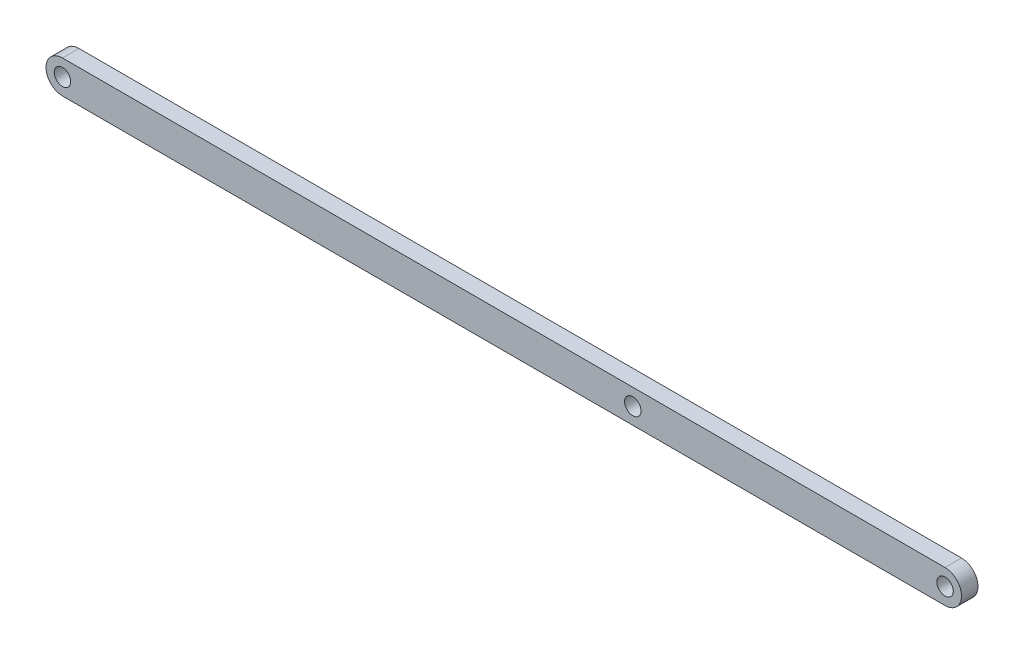
from build123d import *

# Parameters (mm, degrees)
ESBO_O1_R                = 2.5
RESSALTO_EXTRUS_O1_DEPTH = 5


with BuildPart() as part:
    # Esboço1 → Ressalto-extrusão1 (new body)
    with BuildSketch(Plane.XY):
        with BuildLine():
            Line((-227.28, 5), (40.72, 5))
            ThreePointArc((40.72, 5), (45.72, 0), (40.72, -5))
            Line((40.72, -5), (-227.28, -5))
            ThreePointArc((-227.28, -5), (-232.28, 0), (-227.28, 5))
        make_face()
        with Locations((-227.28, 0)):
            Circle(ESBO_O1_R, mode=Mode.SUBTRACT)
        with Locations((40.72, 0)):
            Circle(ESBO_O1_R, mode=Mode.SUBTRACT)
        with Locations((-54.1, 0)):
            Circle(ESBO_O1_R, mode=Mode.SUBTRACT)
    extrude(amount=RESSALTO_EXTRUS_O1_DEPTH)


solid = part.part
